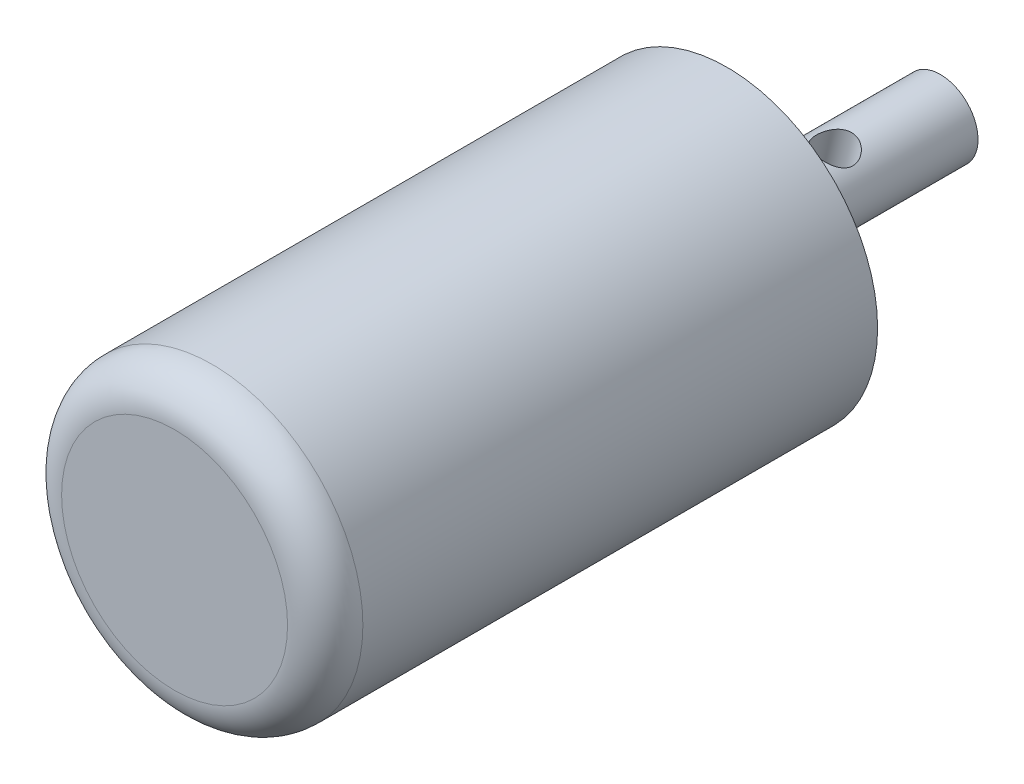
from build123d import *

# Parameters (mm, degrees)
SKETCH_1_R          = 12
EXTRUDE_1_DEPTH     = 44
SKETCH_2_R          = 6.5
EXTRUDE_2_DEPTH     = 2
SKETCH_3_R          = 3
EXTRUDE_3_DEPTH     = 15
SKETCH_4_R          = 1.5
CUT_EXTRUDE_1_DEPTH = 5
CUT_EXTRUDE_START   = -11.5
CUT_EXTRUDE_2_DEPTH = 11.5
SKETCH_6_R          = 1.5
CUT_EXTRUDE_3_DEPTH = 48.977426709
FILLET_1_R          = 3


with BuildPart() as part:
    # 草图1 → 凸台-拉伸1 (new body)
    with BuildSketch(Plane.XY):
        Circle(SKETCH_1_R)
    extrude(amount=EXTRUDE_1_DEPTH)

    # 草图2 → 凸台-拉伸2 (add)
    with BuildSketch(Plane(origin=(0, 0, 0), x_dir=(-1, 0, 0), z_dir=(0, 0, -1))):
        Circle(SKETCH_2_R)
    extrude(amount=EXTRUDE_2_DEPTH)

    # 草图3 → 凸台-拉伸3 (add)
    with BuildSketch(Plane(origin=(0, 0, -2), x_dir=(-1, 0, 0), z_dir=(0, 0, -1))):
        Circle(SKETCH_3_R)
    extrude(amount=EXTRUDE_3_DEPTH)

    # 草图4 → 切除-拉伸1 (cut)
    with BuildSketch(Plane(origin=(0, 0, 0), x_dir=(-1, 0, 0), z_dir=(0, 0, -1))):
        with Locations((0, -9)):
            Circle(SKETCH_4_R)
        with Locations((-7.794228634, 4.5)):
            Circle(SKETCH_4_R)
        with Locations((7.794228634, 4.5)):
            Circle(SKETCH_4_R)
    extrude(amount=-CUT_EXTRUDE_1_DEPTH, mode=Mode.SUBTRACT)

    # 草图5 → 切除-拉伸2 (cut)
    with BuildSketch(Plane(origin=(0, 0, -17), x_dir=(-1, 0, 0), z_dir=(0, 0, -1)).offset(CUT_EXTRUDE_START)):
        with BuildLine():
            Line((2.160985852, -2.08089888), (-1.076716839, -2.800121578))
            ThreePointArc((-1.076716839, -2.800121578), (0.650561408, -2.928612275), (2.160985852, -2.08089888))
        make_face()
    extrude(amount=CUT_EXTRUDE_2_DEPTH, mode=Mode.SUBTRACT)

    # 草图6 → 切除-拉伸3 (cut, through all)
    with BuildSketch(Plane(origin=(-0.542134506, -2.440510229, 0), x_dir=(-0.9762040915238366, 0.2168538025770379, 0), z_dir=(-0.2168538025770379, -0.9762040915238366, 0))):
        with Locations(Location((0, 8, 0), (0, 0, 180))):
            Circle(SKETCH_6_R)
    extrude(amount=-CUT_EXTRUDE_3_DEPTH, mode=Mode.SUBTRACT)

    # 圆角1
    fillet_1_edges = [part.edges().sort_by_distance(p)[0] for p in [
        (-12, 0, 44),
    ]]
    fillet(fillet_1_edges, radius=FILLET_1_R)


solid = part.part
